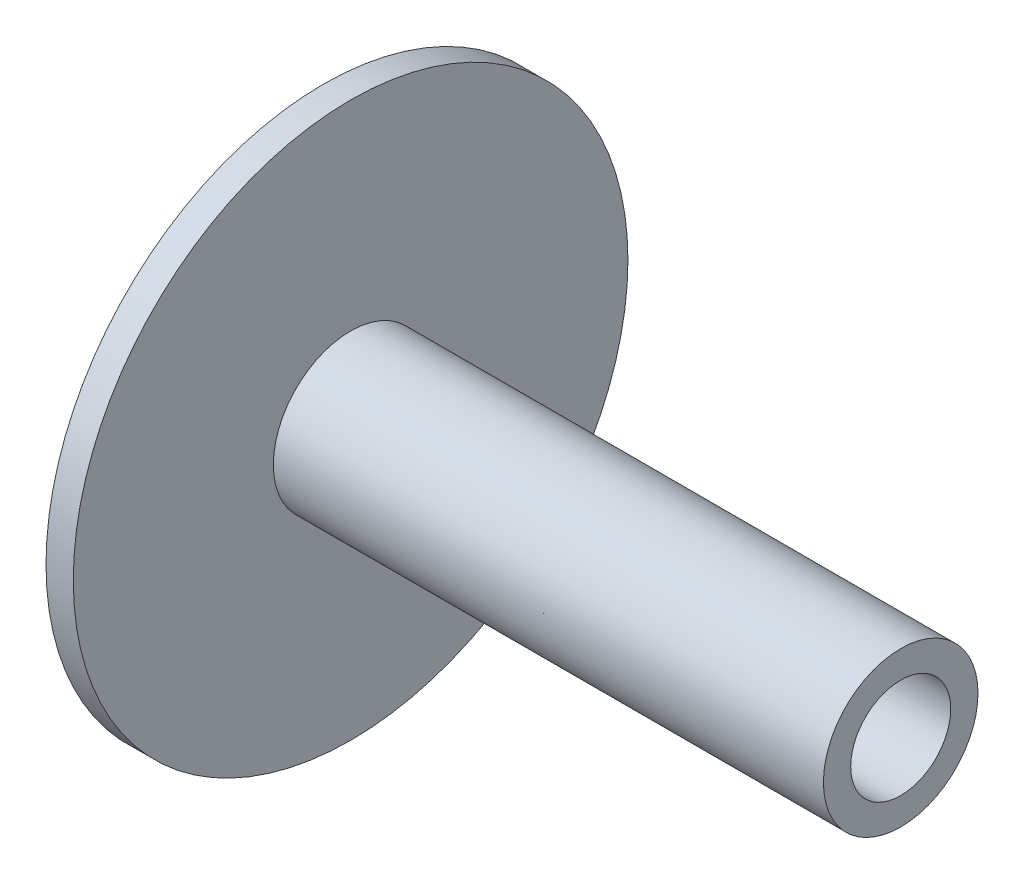
from build123d import *
from build123d.topology import SkipClean

# Parameters (mm, degrees)
SKETCH1_R           = 3.4
SKETCH1_R_2         = 2.2
BOSS_EXTRUDE1_DEPTH = 24.2
BOSS_EXTRUDE2_START = 1.2
SKETCH3_R           = 12.2
SKETCH3_R_2         = 2.2
BOSS_EXTRUDE2_DEPTH = 1.2


with BuildPart() as part:
    # Sketch1 → Boss-Extrude1 (new body)
    with BuildSketch(Plane(origin=(0, 0, 0), x_dir=(0, 0, -1), z_dir=(1, 0, 0))):
        Circle(SKETCH1_R)
        Circle(SKETCH1_R_2, mode=Mode.SUBTRACT)
    extrude(amount=BOSS_EXTRUDE1_DEPTH)

    # Sketch3 → Boss-Extrude2 (add)
    with SkipClean():  # the faces are left unmerged after this step: merging them gives an invalid solid
        with BuildSketch(Plane.ZY.offset(BOSS_EXTRUDE2_START)):
            Circle(SKETCH3_R)
            Circle(SKETCH3_R_2, mode=Mode.SUBTRACT)
        extrude(amount=-BOSS_EXTRUDE2_DEPTH)


solid = part.part
